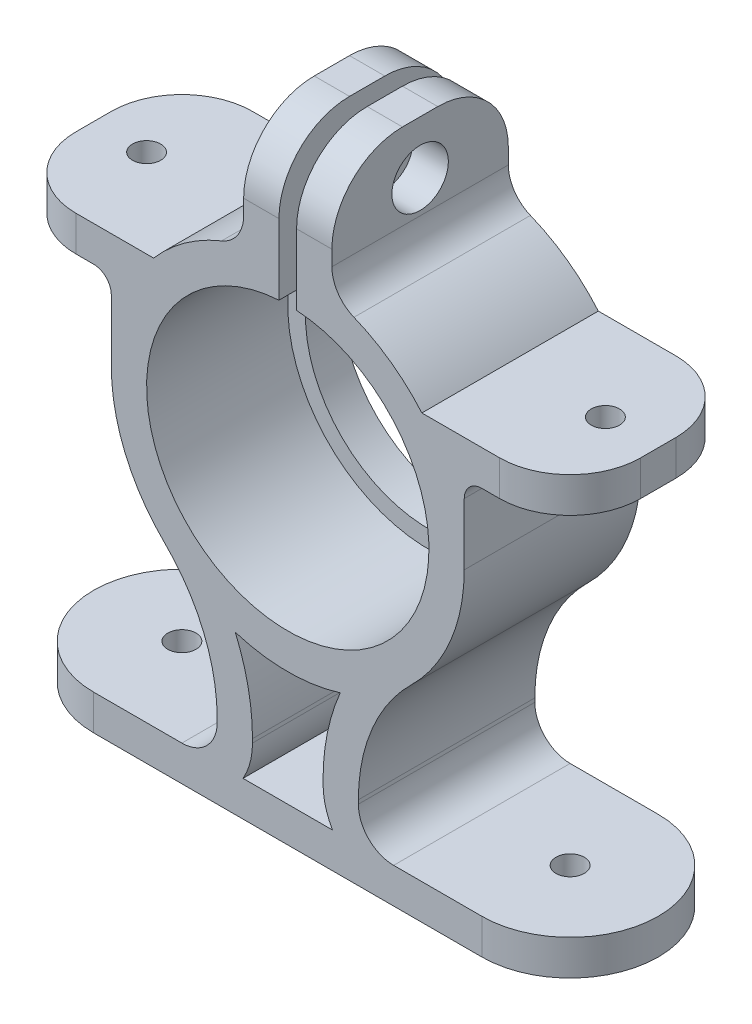
from build123d import *

# Parameters (mm, degrees)
BOSS_EXTRUDE1_DEPTH = 10
SKETCH3_R           = 0.8
CUT_EXTRUDE1_DEPTH  = 2
SKETCH4_R           = 0.8
CUT_EXTRUDE2_DEPTH  = 2
SKETCH5_R           = 0.8
CUT_EXTRUDE3_DEPTH  = 2
SKETCH6_R           = 0.8
CUT_EXTRUDE4_DEPTH  = 3
SKETCH7_R           = 1.6
CUT_EXTRUDE5_DEPTH  = 3
CUT_EXTRUDE6_DEPTH  = 10
BOSS_EXTRUDE2_DEPTH = 2


with BuildPart() as part:
    # Sketch1 → Boss-Extrude1 (new body)
    with BuildSketch(Plane.XY):
        with BuildLine():
            Line((16.803004448, 0), (48.803096805, 0))
            Line((48.803096805, 0), (48.803096805, 2))
            Line((48.803096805, 2), (38.803096805, 2))
            ThreePointArc((38.803096805, 2), (37.388883243, 2.585786438), (36.803096805, 4))
            Line((36.803096805, 4), (36.803096805, 4.217123744))
            ThreePointArc((36.803096805, 4.217123744), (37.58355047, 8.090102619), (39.803089878, 11.358545383))
            ThreePointArc((39.803089878, 11.358545383), (42.022639537, 14.62700324), (42.803096805, 18.5))
            Line((42.803096805, 18.5), (42.803096805, 22))
            ThreePointArc((42.803096805, 22), (43.095990024, 22.707106781), (43.803096805, 23))
            Line((43.803096805, 23), (48.803096805, 23))
            Line((48.803096805, 23), (48.803096805, 25))
            Line((48.803096805, 25), (44.105786895, 25))
            Line((44.105786895, 25), (40.40245347, 25))
            ThreePointArc((40.40245347, 25), (38.644426823, 26.616603213), (36.553207437, 27.770234489))
            ThreePointArc((36.553207437, 27.770234489), (35.644914528, 28.506251313), (35.303235335, 29.624272825))
            Line((35.303235335, 29.624272825), (35.303235335, 34.487492178))
            Line((35.303235335, 34.487492178), (33.303050626, 34.487492178))
            Line((33.303050626, 34.487492178), (33.303050626, 26.484348185))
            ThreePointArc((33.303050626, 26.484348185), (32.803050626, 10.500011503), (32.303050626, 26.484348185))
            Line((32.303050626, 26.484348185), (32.303050626, 34.487492178))
            Line((32.303050626, 34.487492178), (30.303050626, 34.487492178))
            Line((30.303050626, 34.487492178), (30.303050626, 29.624347545))
            ThreePointArc((30.303050626, 29.624347545), (29.961362151, 28.506312265), (29.05304774, 27.770296755))
            ThreePointArc((29.05304774, 27.770296755), (26.961741815, 26.616651708), (25.203647783, 25))
            Line((25.203647783, 25), (21.500314358, 25))
            Line((21.500314358, 25), (16.803004448, 25))
            Line((16.803004448, 25), (16.803004448, 23))
            Line((16.803004448, 23), (21.803004448, 23))
            ThreePointArc((21.803004448, 23), (22.510111229, 22.707106781), (22.803004448, 22))
            Line((22.803004448, 22), (22.803004448, 18.5))
            ThreePointArc((22.803004448, 18.5), (23.583461716, 14.62700324), (25.803011375, 11.358545383))
            ThreePointArc((25.803011375, 11.358545383), (28.022550783, 8.090102619), (28.803004448, 4.217123744))
            Line((28.803004448, 4.217123744), (28.803004448, 4))
            ThreePointArc((28.803004448, 4), (28.21721801, 2.585786438), (26.803004448, 2))
            Line((26.803004448, 2), (16.803004448, 2))
            Line((16.803004448, 2), (16.803004448, 0))
        make_face()
        with BuildLine():
            Line((34.803096805, 4), (34.803096805, 4.217123744))
            ThreePointArc((34.803096805, 4.217123744), (35.049071096, 6.634328662), (35.776910074, 8.952438536))
            ThreePointArc((35.776910074, 8.952438536), (32.803050626, 8.500011503), (29.829191179, 8.952438536))
            ThreePointArc((29.829191179, 8.952438536), (30.557030157, 6.634328662), (30.803004448, 4.217123744))
            Line((30.803004448, 4.217123744), (30.803004448, 4))
            ThreePointArc((30.803004448, 4), (30.666707753, 2.96472382), (30.267106063, 2))
            Line((30.267106063, 2), (35.33899519, 2))
            ThreePointArc((35.33899519, 2), (34.9393935, 2.96472382), (34.803096805, 4))
        make_face(mode=Mode.SUBTRACT)
    extrude(amount=BOSS_EXTRUDE1_DEPTH)

    # Sketch3 → Cut-Extrude1 (cut)
    with BuildSketch(Plane(origin=(0, 2, 0), x_dir=(1, 0, 0), z_dir=(0, 1, 0))):
        with BuildLine():
            ThreePointArc((48.803096805, -5), (47.338630711, -8.535533906), (43.803096805, -10))
            Line((43.803096805, -10), (48.803096805, -10))
            Line((48.803096805, -10), (48.803096805, -5))
        make_face()
        with BuildLine():
            ThreePointArc((43.803096805, 0), (47.338630711, -1.464466094), (48.803096805, -5))
            Line((48.803096805, -5), (48.803096805, 0))
            Line((48.803096805, 0), (43.803096805, 0))
        make_face()
        with Locations((43.803096805, -5)):
            Circle(SKETCH3_R)
    extrude(amount=-CUT_EXTRUDE1_DEPTH, mode=Mode.SUBTRACT)

    # Sketch4 → Cut-Extrude2 (cut)
    with BuildSketch(Plane(origin=(0, 2, 0), x_dir=(1, 0, 0), z_dir=(0, 1, 0))):
        with BuildLine():
            Line((16.803004448, 0), (16.803004448, -5))
            ThreePointArc((16.803004448, -5), (18.267470542, -1.464466094), (21.803004448, 0))
            Line((21.803004448, 0), (16.803004448, 0))
        make_face()
        with BuildLine():
            Line((16.803004448, -10), (21.803004448, -10))
            ThreePointArc((21.803004448, -10), (18.267470542, -8.535533906), (16.803004448, -5))
            Line((16.803004448, -5), (16.803004448, -10))
        make_face()
        with Locations((21.803004448, -5)):
            Circle(SKETCH4_R)
    extrude(amount=-CUT_EXTRUDE2_DEPTH, mode=Mode.SUBTRACT)

    # Sketch5 → Cut-Extrude3 (cut)
    with BuildSketch(Plane(origin=(0, 25, 0), x_dir=(1, 0, 0), z_dir=(0, 1, 0))):
        with Locations((19.803004448, -5)):
            Circle(SKETCH5_R)
        with Locations((45.803096805, -5)):
            Circle(SKETCH5_R)
        with BuildLine():
            Line((20.803004448, -10), (16.803004448, -10))
            Line((16.803004448, -10), (16.803004448, -6))
            ThreePointArc((16.803004448, -6), (17.974577323, -8.828427125), (20.803004448, -10))
        make_face()
        with BuildLine():
            Line((16.803004448, -4), (16.803004448, 0))
            Line((16.803004448, 0), (20.803004448, 0))
            ThreePointArc((20.803004448, 0), (17.974577323, -1.171572875), (16.803004448, -4))
        make_face()
        with BuildLine():
            Line((44.803096805, 0), (48.803096805, 0))
            Line((48.803096805, 0), (48.803096805, -4))
            ThreePointArc((48.803096805, -4), (47.63152393, -1.171572875), (44.803096805, 0))
        make_face()
        with BuildLine():
            Line((48.803096805, -6), (48.803096805, -10))
            Line((48.803096805, -10), (44.803096805, -10))
            ThreePointArc((44.803096805, -10), (47.63152393, -8.828427125), (48.803096805, -6))
        make_face()
    extrude(amount=-CUT_EXTRUDE3_DEPTH, mode=Mode.SUBTRACT)

    # Sketch6 → Cut-Extrude4 (cut)
    with BuildSketch(Plane.ZY.offset(-30.303050626)):
        with Locations((5, 31.487492178)):
            Circle(SKETCH6_R)
    extrude(amount=-CUT_EXTRUDE4_DEPTH, mode=Mode.SUBTRACT)

    # Sketch7 → Cut-Extrude5 (cut)
    with BuildSketch(Plane(origin=(35.303235335, 0, 0), x_dir=(0, 0, -1), z_dir=(1, 0, 0))):
        with Locations((-5, 31.487492178)):
            Circle(SKETCH7_R)
    extrude(amount=-CUT_EXTRUDE5_DEPTH, mode=Mode.SUBTRACT)

    # Sketch8 → Cut-Extrude6 (cut)
    with BuildSketch(Plane.ZY.offset(-30.303050626)):
        with BuildLine():
            Line((0, 30.487492178), (0, 34.487492178))
            Line((0, 34.487492178), (4, 34.487492178))
            ThreePointArc((4, 34.487492178), (1.171572875, 33.315919302), (0, 30.487492178))
        make_face()
        with BuildLine():
            Line((6, 34.487492178), (10, 34.487492178))
            Line((10, 34.487492178), (10, 30.487492178))
            ThreePointArc((10, 30.487492178), (8.828427125, 33.315919302), (6, 34.487492178))
        make_face()
    extrude(amount=-CUT_EXTRUDE6_DEPTH, mode=Mode.SUBTRACT)

    # Sketch9 → Boss-Extrude2 (add)
    with BuildSketch(Plane(origin=(0, 0, 0), x_dir=(-1, 0, 0), z_dir=(0, 0, -1))):
        with BuildLine():
            Line((-33.303050626, 26.484348185), (-33.303050626, 25.482120022))
            ThreePointArc((-33.303050626, 25.482120022), (-32.803050626, 11.5), (-32.303050626, 25.482120022))
            Line((-32.303050626, 25.482120022), (-32.303050626, 26.484348185))
            ThreePointArc((-32.303050626, 26.484348185), (-32.803050626, 10.500011503), (-33.303050626, 26.484348185))
        make_face()
    extrude(amount=-BOSS_EXTRUDE2_DEPTH)


solid = part.part
